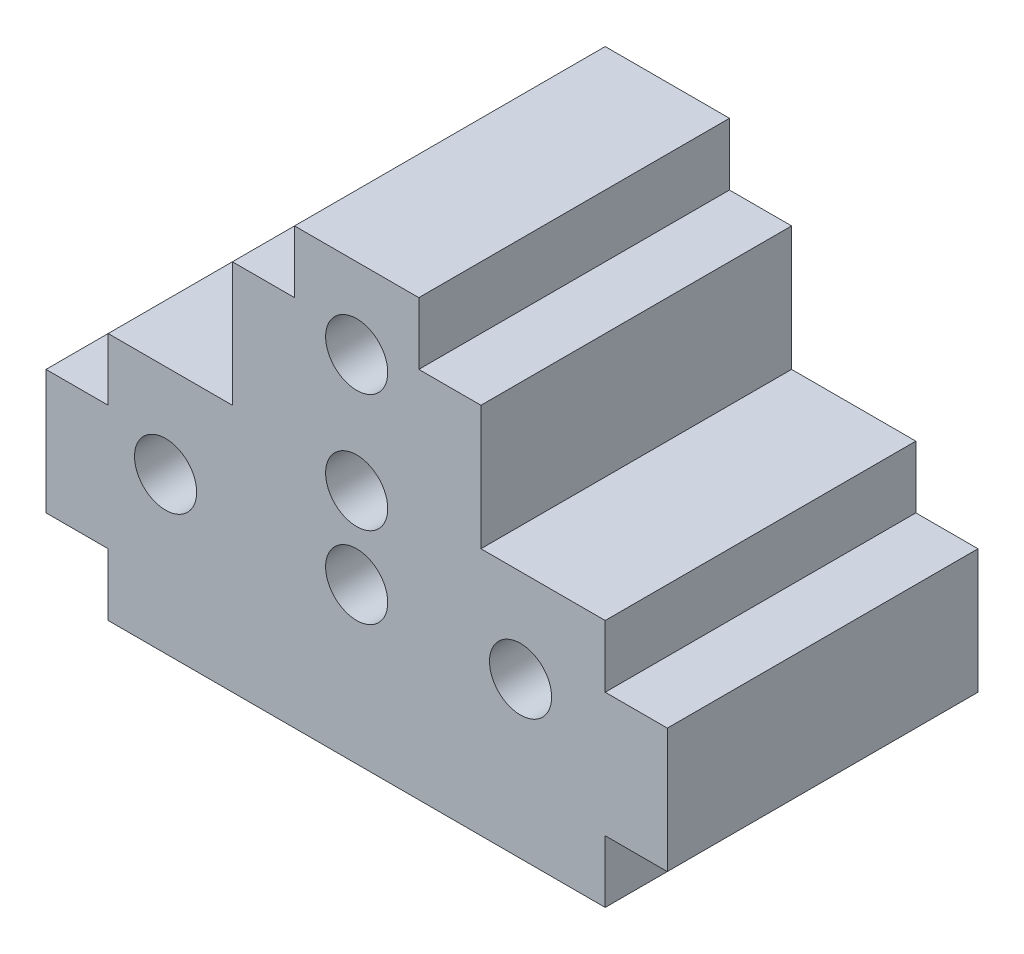
from build123d import *

# Parameters (mm, degrees)
BOSS_EXTRUDE1_DEPTH = 5
SKETCH2_R           = 1
CUT_EXTRUDE1_DEPTH  = 10


with BuildPart() as part:
    # Sketch1 → Boss-Extrude1 (new, symmetric)
    with BuildSketch(Plane.XY):
        Polygon((-8, 0), (-8, 2), (-10, 2), (-10, 6), (-8, 6), (-8, 8), (-4, 8), (-4, 12), (-2, 12), (-2, 14), (2, 14), (2, 12), (4, 12), (4, 8), (8, 8), (8, 6), (10, 6), (10, 2), (8, 2), (8, 0), align=None)
    extrude(amount=BOSS_EXTRUDE1_DEPTH, both=True)

    # Sketch2 → Cut-Extrude1 (cut)
    with BuildSketch(Plane.XY.offset(5)):
        with Locations((0, 5)):
            Circle(SKETCH2_R)
        with Locations((0, 7.616750923)):
            Circle(SKETCH2_R)
        with Locations((0, 11.414638185)):
            Circle(SKETCH2_R)
        with Locations((-6.151278942, 5)):
            Circle(SKETCH2_R)
        with Locations((5.27484342, 5)):
            Circle(SKETCH2_R)
    extrude(amount=-CUT_EXTRUDE1_DEPTH, mode=Mode.SUBTRACT)


solid = part.part
